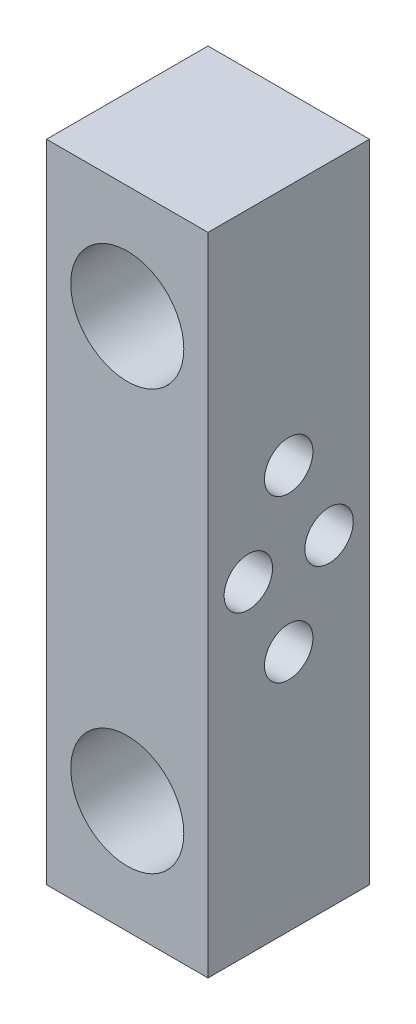
from build123d import *

# Parameters (mm, degrees)
SKETCH_1_W          = 10
SKETCH_1_H          = 40
SKETCH_1_R          = 3.5
EXTRUDE_1_DEPTH     = 10
SKETCH_2_R          = 1.5
CUT_EXTRUDE_1_DEPTH = 25.494897428


with BuildPart() as part:
    # 草图1 → 凸台-拉伸1 (new body)
    with BuildSketch(Plane.XY):
        Rectangle(SKETCH_1_W, SKETCH_1_H)
        with Locations((0, 13)):
            Circle(SKETCH_1_R, mode=Mode.SUBTRACT)
        with Locations((0, -13)):
            Circle(SKETCH_1_R, mode=Mode.SUBTRACT)
    extrude(amount=EXTRUDE_1_DEPTH)

    # 草图2 → 切除-拉伸1 (cut, through all)
    with BuildSketch(Plane(origin=(5, 0, 0), x_dir=(0, 0, -1), z_dir=(1, 0, 0))):
        with Locations(Location((-5, 5, 0), (0, 0, 90))):
            Circle(SKETCH_2_R)
        with Locations(Location((-5, -5, 0), (0, 0, 90))):
            Circle(SKETCH_2_R)
        with Locations(Location((-2.5, 0, 0), (0, 0, 90))):
            Circle(SKETCH_2_R)
        with Locations(Location((-7.5, 0, 0), (0, 0, 90))):
            Circle(SKETCH_2_R)
    extrude(amount=-CUT_EXTRUDE_1_DEPTH, mode=Mode.SUBTRACT)


solid = part.part
